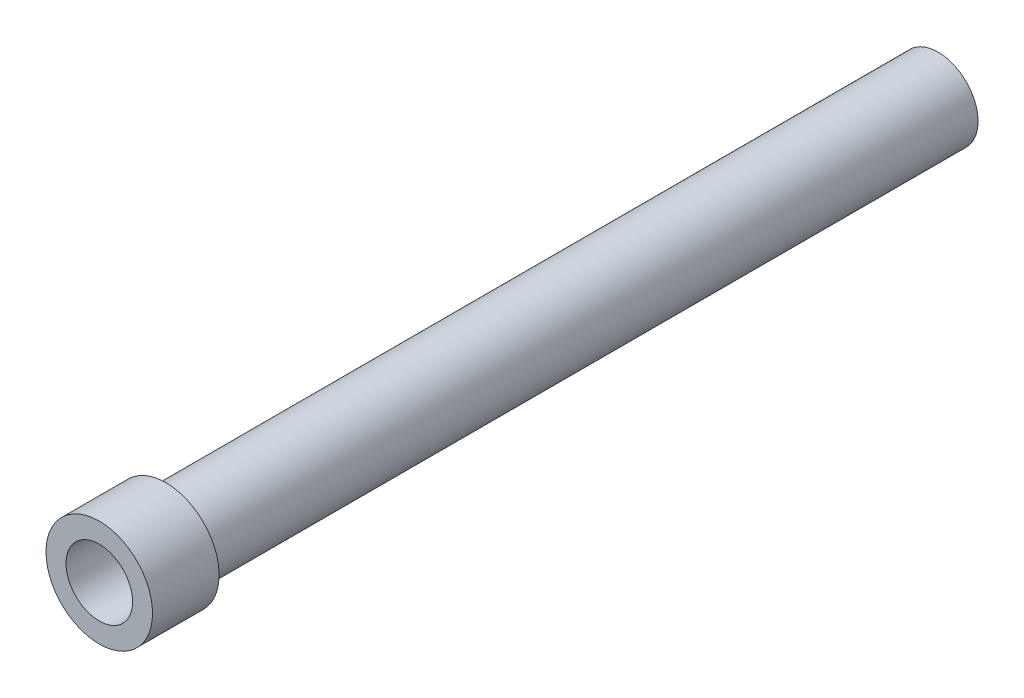
from build123d import *

# Parameters (mm, degrees)
SKIZZE1_R                       = 4
AUFSATZ_LINEAR_AUSTRAGEN1_DEPTH = 63
SKIZZE2_R                       = 2.5
SCHNITT_LINEAR_AUSTRAGEN1_DEPTH = 27
SKIZZE3_R                       = 12.769442974
SKIZZE3_R_2                     = 3
SCHNITT_LINEAR_AUSTRAGEN2_DEPTH = 58


with BuildPart() as part:
    # Skizze1 → Aufsatz-Linear austragen1 (new body)
    with BuildSketch(Plane.XY):
        with Locations((-21.202438913, 3.95852329)):
            Circle(SKIZZE1_R)
    extrude(amount=AUFSATZ_LINEAR_AUSTRAGEN1_DEPTH)

    # Skizze2 → Schnitt-Linear austragen1 (cut)
    with BuildSketch(Plane.XY.offset(63)):
        with Locations((-21.202438913, 3.95852329)):
            Circle(SKIZZE2_R)
    extrude(amount=-SCHNITT_LINEAR_AUSTRAGEN1_DEPTH, mode=Mode.SUBTRACT)

    # Skizze3 → Schnitt-Linear austragen2 (cut)
    with BuildSketch(Plane(origin=(0, 0, 0), x_dir=(-1, 0, 0), z_dir=(0, 0, -1))):
        with Locations((21.202438913, 3.95852329)):
            Circle(SKIZZE3_R)
        with Locations((21.202438913, 3.95852329)):
            Circle(SKIZZE3_R_2, mode=Mode.SUBTRACT)
    extrude(amount=-SCHNITT_LINEAR_AUSTRAGEN2_DEPTH, mode=Mode.SUBTRACT)


solid = part.part
